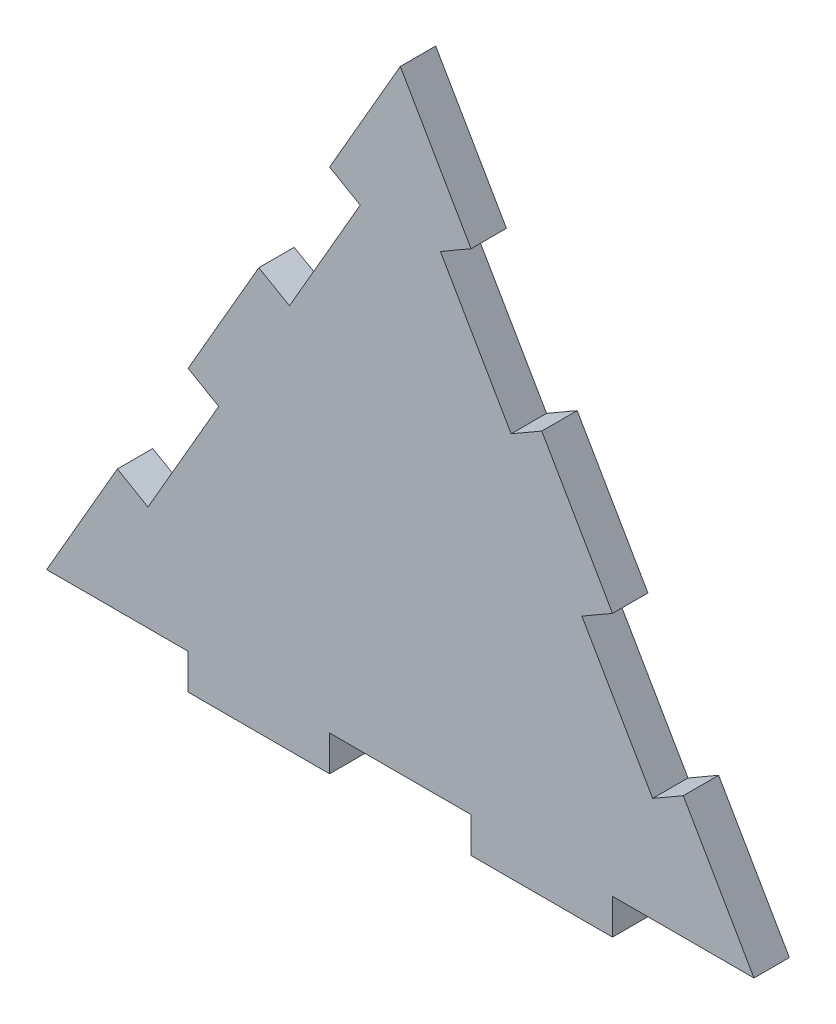
from build123d import *

# Parameters (mm, degrees)
BOSS_EXTRU_1_DEPTH      = 5
ESQUISSE2_W             = 20
ESQUISSE2_H             = 5
BOSS_EXTRU_2_DEPTH      = 5
ENL_V_MAT_EXTRU_1_DEPTH = 133.382022949


with BuildPart() as part:
    # Esquisse1 → Boss.-Extru.1 (new body)
    with BuildSketch(Plane.XY):
        Polygon((0, 0), (-100, 0), (-50, 86.602540378), align=None)
    extrude(amount=BOSS_EXTRU_1_DEPTH)

    # Esquisse2 → Boss.-Extru.2 (add)
    with BuildSketch(Plane(origin=(0, 0, 0), x_dir=(-1, 0, 0), z_dir=(0, 0, -1))):
        with Locations((30, -2.5)):
            Rectangle(ESQUISSE2_W, ESQUISSE2_H)
        with Locations((70, -2.5)):
            Rectangle(ESQUISSE2_W, ESQUISSE2_H)
    extrude(amount=-BOSS_EXTRU_2_DEPTH)

    # Esquisse3 → Enlèv. mat.-Extru.1 (cut, through all)
    with BuildSketch(Plane.XY.offset(5)):
        Polygon((-60, 69.282032303), (-55.669872981, 66.782032303), (-65.669872981, 49.461524227), (-70, 51.961524227), align=None)
        Polygon((-80, 34.641016151), (-75.669872981, 32.141016151), (-85.669872981, 14.820508076), (-90, 17.320508076), align=None)
        Polygon((-10, 17.320508076), (-20, 34.641016151), (-24.330127019, 32.141016151), (-14.330127019, 14.820508076), align=None)
        Polygon((-30, 51.961524227), (-40, 69.282032303), (-44.330127019, 66.782032303), (-34.330127019, 49.461524227), align=None)
    extrude(amount=-ENL_V_MAT_EXTRU_1_DEPTH, mode=Mode.SUBTRACT)


solid = part.part
